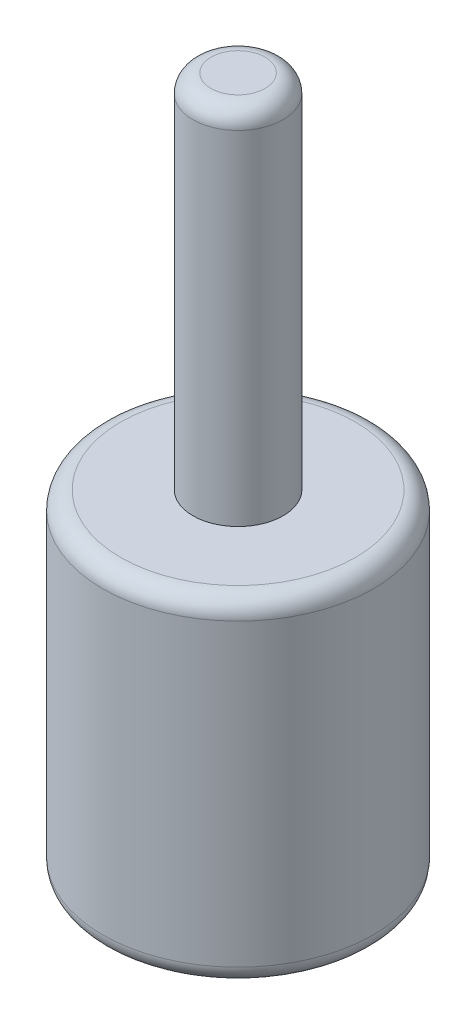
from build123d import *

# Parameters (mm, degrees)
ESBO_O1_R                = 7.5
RESSALTO_EXTRUS_O1_DEPTH = 18.6
ESBO_O2_R                = 2.5
RESSALTO_EXTRUS_O2_DEPTH = 20
FILETE1_R                = 1


with BuildPart() as part:
    # Esboço1 → Ressalto-extrusão1 (new body)
    with BuildSketch(Plane(origin=(0, 0, 0), x_dir=(1, 0, 0), z_dir=(0, 1, 0))):
        with Locations(Location((-2.131243559, 0, 0), (0, 0, 270))):
            Circle(ESBO_O1_R)
    extrude(amount=RESSALTO_EXTRUS_O1_DEPTH)

    # Esboço2 → Ressalto-extrusão2 (add)
    with BuildSketch(Plane(origin=(0, 18.6, 0), x_dir=(1, 0, 0), z_dir=(0, 1, 0))):
        with Locations(Location((-2.131243559, 0, 0), (0, 0, 270))):
            Circle(ESBO_O2_R)
    extrude(amount=RESSALTO_EXTRUS_O2_DEPTH)

    # Filete1
    filete1_edges = [part.edges().sort_by_distance(p)[0] for p in [
        (-2.131243559, 0, -7.5),
        (-2.131243559, 18.6, -7.5),
        (-2.131243559, 38.6, -2.5),
    ]]
    fillet(filete1_edges, radius=FILETE1_R)


solid = part.part
